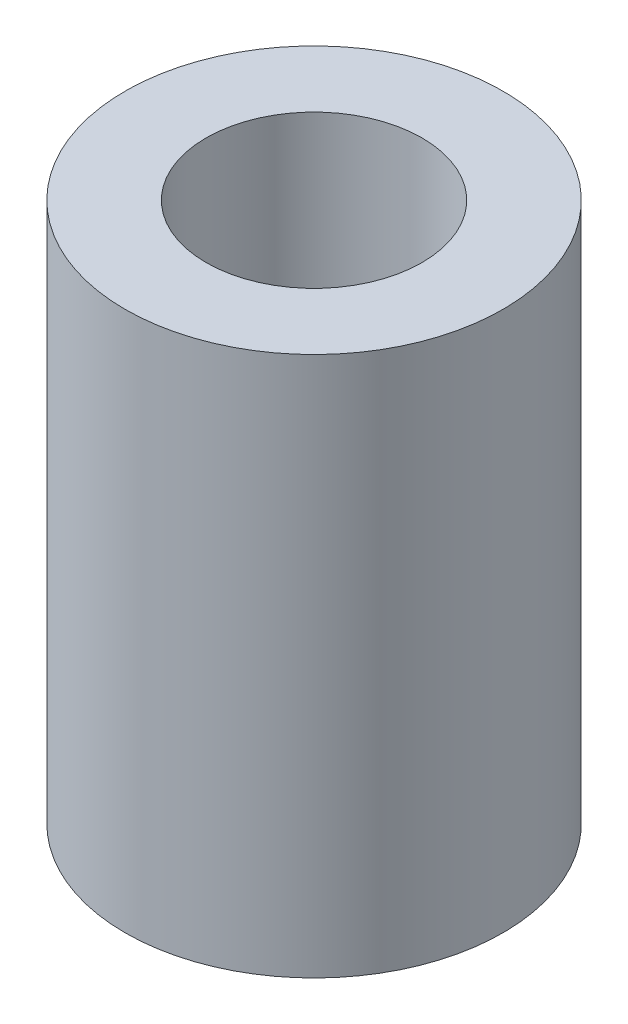
from build123d import *

# Parameters (mm, degrees)
SKETCH1_R           = 3.5
SKETCH1_R_2         = 2
BOSS_EXTRUDE1_DEPTH = 10


with BuildPart() as part:
    # Sketch1 → Boss-Extrude1 (new body)
    with BuildSketch(Plane(origin=(0, 0, 0), x_dir=(1, 0, 0), z_dir=(0, 1, 0))):
        with Locations(Location((0, 0, 0), (0, 0, 270))):
            Circle(SKETCH1_R)
        with Locations(Location((0, 0, 0), (0, 0, 270))):
            Circle(SKETCH1_R_2, mode=Mode.SUBTRACT)
    extrude(amount=BOSS_EXTRUDE1_DEPTH)


solid = part.part
